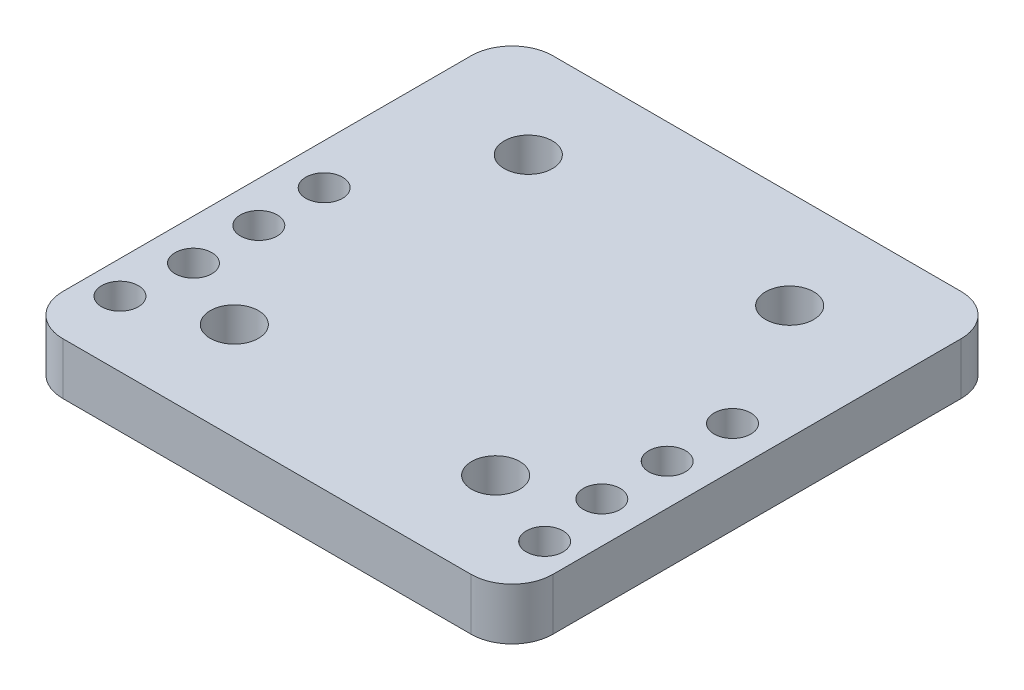
from build123d import *

# Parameters (mm, degrees)
SKETCH1_W           = 60
SKETCH1_H           = 60
SKETCH1_R           = 2.95
SKETCH1_R_2         = 2.25
BOSS_EXTRUDE1_DEPTH = 6.35
FILLET1_R           = 5


with BuildPart() as part:
    # Sketch1 → Boss-Extrude1 (new body)
    with BuildSketch(Plane(origin=(0, 0, 0), x_dir=(1, 0, 0), z_dir=(0, 1, 0))):
        with Locations((30, 30)):
            Rectangle(SKETCH1_W, SKETCH1_H)
        with Locations(Location((14, 48, 0), (0, 0, 270))):
            Circle(SKETCH1_R, mode=Mode.SUBTRACT)
        with Locations(Location((46, 48, 0), (0, 0, 270))):
            Circle(SKETCH1_R, mode=Mode.SUBTRACT)
        with Locations(Location((46, 12, 0), (0, 0, 270))):
            Circle(SKETCH1_R, mode=Mode.SUBTRACT)
        with Locations(Location((14, 12, 0), (0, 0, 270))):
            Circle(SKETCH1_R, mode=Mode.SUBTRACT)
        with Locations(Location((56, 8, 0), (0, 0, 270))):
            Circle(SKETCH1_R_2, mode=Mode.SUBTRACT)
        with Locations(Location((4, 8, 0), (0, 0, 90))):
            Circle(SKETCH1_R_2, mode=Mode.SUBTRACT)
        with Locations(Location((55, 16, 0), (0, 0, 270))):
            Circle(SKETCH1_R_2, mode=Mode.SUBTRACT)
        with Locations(Location((55, 24, 0), (0, 0, 270))):
            Circle(SKETCH1_R_2, mode=Mode.SUBTRACT)
        with Locations(Location((55, 32, 0), (0, 0, 270))):
            Circle(SKETCH1_R_2, mode=Mode.SUBTRACT)
        with Locations(Location((5, 32, 0), (0, 0, 90))):
            Circle(SKETCH1_R_2, mode=Mode.SUBTRACT)
        with Locations(Location((5, 24, 0), (0, 0, 90))):
            Circle(SKETCH1_R_2, mode=Mode.SUBTRACT)
        with Locations(Location((5, 16, 0), (0, 0, 90))):
            Circle(SKETCH1_R_2, mode=Mode.SUBTRACT)
    extrude(amount=BOSS_EXTRUDE1_DEPTH)

    # Fillet1
    fillet1_edges = [part.edges().sort_by_distance(p)[0] for p in [
        (0, 3.175, -60),
        (60, 3.175, -60),
        (60, 3.175, 0),
        (0, 3.175, 0),
    ]]
    fillet(fillet1_edges, radius=FILLET1_R)


solid = part.part
